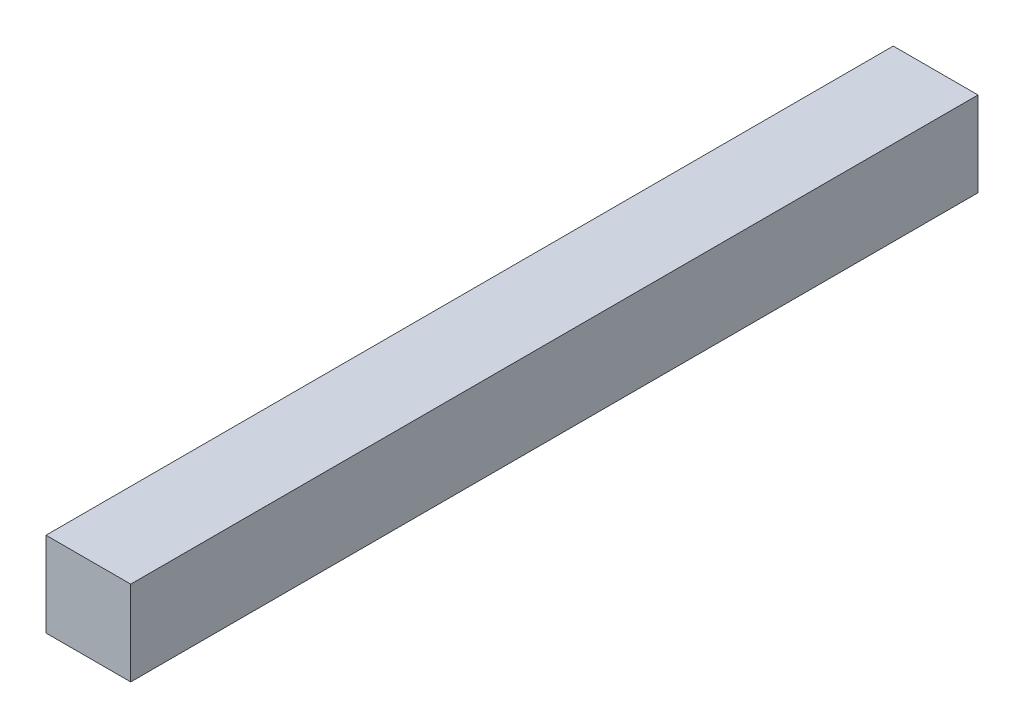
from build123d import *

# Parameters (mm, degrees)
SKETCH1_W           = 1000
SKETCH1_H           = 1000
BOSS_EXTRUDE1_DEPTH = 10000


with BuildPart() as part:
    # Sketch1 → Boss-Extrude1 (new body)
    with BuildSketch(Plane.XY):
        with Locations((-500, -500)):
            Rectangle(SKETCH1_W, SKETCH1_H)
    extrude(amount=BOSS_EXTRUDE1_DEPTH)


solid = part.part
